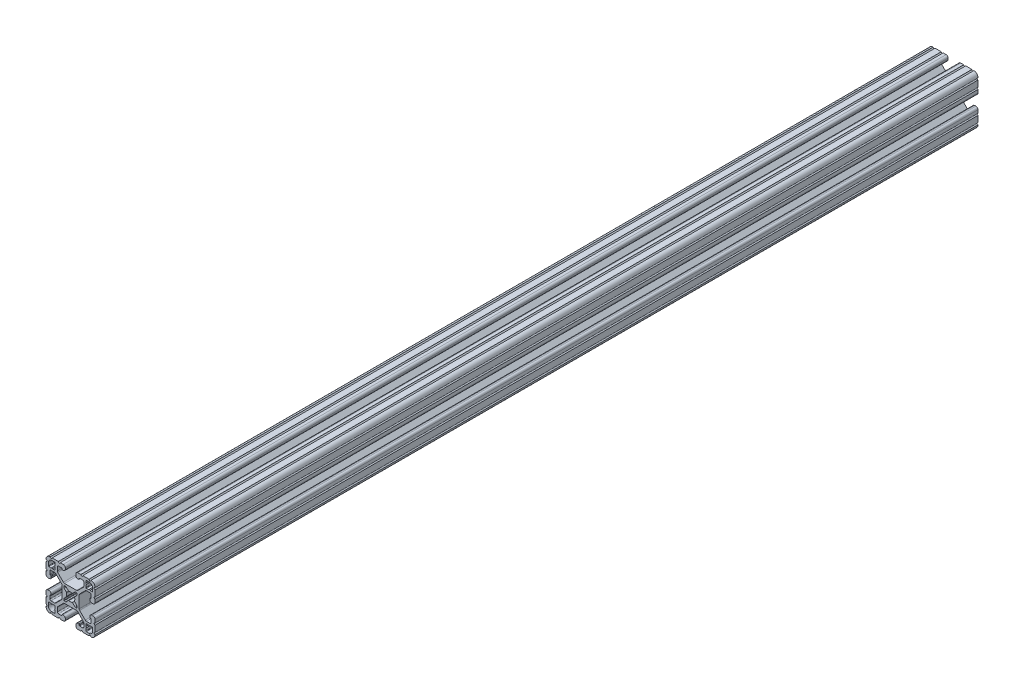
from build123d import *

# Parameters (mm, degrees)
EXTRUDE1_DEPTH = 685.8


with BuildPart() as part:
    # Sketch1 → Extrude1 (new body)
    with BuildSketch(Plane.XY):
        with BuildLine():
            Line((6.349777007, -14.984831919), (5.653061318, -14.984831848))
            ThreePointArc((5.653061318, -14.984831848), (4.539002167, -15.446080098), (4.077754017, -16.560139291))
            Line((4.077754017, -16.560139291), (4.077753935, -17.474692556))
            ThreePointArc((4.077753935, -17.474692556), (4.539002158, -18.588751741), (5.653061362, -19.049999918))
            Line((5.653061362, -19.049999918), (7.975599859, -19.05))
            ThreePointArc((7.975599859, -19.05), (8.737599929, -18.288), (9.4996, -19.05))
            Line((9.4996, -19.05), (14.298091988, -19.05))
            ThreePointArc((14.298091988, -19.05), (15.05987163, -18.288000032), (15.822092002, -19.049559142))
            ThreePointArc((15.822092002, -19.049559142), (18.110316678, -18.129769245), (19.049898398, -15.849599993))
            ThreePointArc((19.049898398, -15.849599993), (18.288000002, -15.087549199), (19.05, -14.3256))
            Line((19.05, -14.3256), (19.05, -9.499600141))
            ThreePointArc((19.05, -9.499600141), (18.288, -8.737600071), (19.05, -7.9756))
            Line((19.05, -7.9756), (19.05, -5.653061359))
            ThreePointArc((19.05, -5.653061359), (18.588751763, -4.53900218), (17.474692553, -4.077754017))
            Line((17.474692553, -4.077754017), (16.560139293, -4.077753935))
            ThreePointArc((16.560139293, -4.077753935), (15.446080122, -4.539002143), (14.98483193, -5.653061321))
            Line((14.98483193, -5.653061321), (14.984831848, -6.349776986))
            ThreePointArc((14.984831848, -6.349776986), (15.096428348, -6.619420887), (15.366075744, -6.731008942))
            Line((15.366075744, -6.731008942), (15.696937609, -6.730998691))
            ThreePointArc((15.696937609, -6.730998691), (15.966583472, -6.842585282), (16.078181438, -7.112226438))
            Line((16.078181438, -7.112226438), (16.078207121, -9.396837814))
            ThreePointArc((16.078207121, -9.396837814), (15.817838504, -10.026619018), (15.188068118, -10.287013801))
            Line((15.188068118, -10.287013801), (12.352560476, -10.287103022))
            ThreePointArc((12.352560476, -10.287103022), (11.865894357, -10.190173629), (11.453520834, -9.914153164))
            Line((11.453520834, -9.914153164), (7.114725376, -5.565926641))
            ThreePointArc((7.114725376, -5.565926641), (6.840134749, -5.154247475), (6.7437254, -4.668876499))
            Line((6.7437254, -4.668876499), (6.7437254, 4.641368628))
            ThreePointArc((6.7437254, 4.641368628), (6.840134749, 5.126739605), (7.114725376, 5.53841877))
            Line((7.114725376, 5.53841877), (11.480968187, 9.914152308))
            ThreePointArc((11.480968187, 9.914152308), (11.89334171, 10.190172773), (12.380007829, 10.287102166))
            Line((12.380007829, 10.287102166), (15.188068116, 10.287014567))
            ThreePointArc((15.188068116, 10.287014567), (15.817838279, 10.026619243), (16.078206356, 9.396837815))
            Line((16.078206356, 9.396837815), (16.078181509, 7.1122265))
            ThreePointArc((16.078181509, 7.1122265), (15.966583514, 6.842585324), (15.696937607, 6.730998762))
            Line((15.696937607, 6.730998762), (15.366075744, 6.731009012))
            ThreePointArc((15.366075744, 6.731009012), (15.096428376, 6.619420915), (14.984831919, 6.349777007))
            Line((14.984831919, 6.349777007), (14.984831848, 5.653061318))
            ThreePointArc((14.984831848, 5.653061318), (15.446080098, 4.539002167), (16.560139291, 4.077754017))
            Line((16.560139291, 4.077754017), (17.474692556, 4.077753935))
            ThreePointArc((17.474692556, 4.077753935), (18.588751741, 4.539002158), (19.049999918, 5.653061362))
            Line((19.049999918, 5.653061362), (19.05, 7.975599859))
            ThreePointArc((19.05, 7.975599859), (18.288, 8.737599929), (19.05, 9.4996))
            Line((19.05, 9.4996), (19.05, 14.298091988))
            ThreePointArc((19.05, 14.298091988), (18.288000032, 15.05987163), (19.049559142, 15.822092002))
            ThreePointArc((19.049559142, 15.822092002), (18.129769245, 18.110316678), (15.849599993, 19.049898398))
            ThreePointArc((15.849599993, 19.049898398), (15.087549199, 18.288000002), (14.3256, 19.05))
            Line((14.3256, 19.05), (9.499600141, 19.05))
            ThreePointArc((9.499600141, 19.05), (8.737600071, 18.288), (7.9756, 19.05))
            Line((7.9756, 19.05), (5.653061359, 19.05))
            ThreePointArc((5.653061359, 19.05), (4.53900218, 18.588751763), (4.077754017, 17.474692553))
            Line((4.077754017, 17.474692553), (4.077753935, 16.560139293))
            ThreePointArc((4.077753935, 16.560139293), (4.539002143, 15.446080122), (5.653061321, 14.98483193))
            Line((5.653061321, 14.98483193), (6.349776986, 14.984831848))
            ThreePointArc((6.349776986, 14.984831848), (6.619420887, 15.096428348), (6.731008942, 15.366075744))
            Line((6.731008942, 15.366075744), (6.730998691, 15.696937609))
            ThreePointArc((6.730998691, 15.696937609), (6.842585282, 15.966583472), (7.112226438, 16.078181438))
            Line((7.112226438, 16.078181438), (9.396837814, 16.078207121))
            ThreePointArc((9.396837814, 16.078207121), (10.026619018, 15.817838504), (10.287013801, 15.188068118))
            Line((10.287013801, 15.188068118), (10.287103022, 12.352560476))
            ThreePointArc((10.287103022, 12.352560476), (10.190173629, 11.865894357), (9.914153164, 11.453520834))
            Line((9.914153164, 11.453520834), (5.565926641, 7.114725376))
            ThreePointArc((5.565926641, 7.114725376), (5.154247475, 6.840134749), (4.668876499, 6.7437254))
            Line((4.668876499, 6.7437254), (-4.641368628, 6.7437254))
            ThreePointArc((-4.641368628, 6.7437254), (-5.126739605, 6.840134749), (-5.53841877, 7.114725376))
            Line((-5.53841877, 7.114725376), (-9.914152308, 11.480968187))
            ThreePointArc((-9.914152308, 11.480968187), (-10.190172773, 11.89334171), (-10.287102166, 12.380007829))
            Line((-10.287102166, 12.380007829), (-10.287014567, 15.188068116))
            ThreePointArc((-10.287014567, 15.188068116), (-10.026619243, 15.817838279), (-9.396837815, 16.078206356))
            Line((-9.396837815, 16.078206356), (-7.1122265, 16.078181509))
            ThreePointArc((-7.1122265, 16.078181509), (-6.842585324, 15.966583514), (-6.730998762, 15.696937607))
            Line((-6.730998762, 15.696937607), (-6.731008942, 15.366075744))
            ThreePointArc((-6.731008942, 15.366075744), (-6.619420905, 15.096428366), (-6.349777007, 14.984831919))
            Line((-6.349777007, 14.984831919), (-5.653061318, 14.984831848))
            ThreePointArc((-5.653061318, 14.984831848), (-4.539002167, 15.446080098), (-4.077754017, 16.560139291))
            Line((-4.077754017, 16.560139291), (-4.077753935, 17.474692556))
            ThreePointArc((-4.077753935, 17.474692556), (-4.539002158, 18.588751741), (-5.653061362, 19.049999918))
            Line((-5.653061362, 19.049999918), (-7.975599859, 19.05))
            ThreePointArc((-7.975599859, 19.05), (-8.737599929, 18.288), (-9.4996, 19.05))
            Line((-9.4996, 19.05), (-14.298091988, 19.05))
            ThreePointArc((-14.298091988, 19.05), (-15.05987163, 18.288000032), (-15.822092002, 19.049559142))
            ThreePointArc((-15.822092002, 19.049559142), (-18.110316678, 18.129769245), (-19.049898398, 15.849599993))
            ThreePointArc((-19.049898398, 15.849599993), (-18.288000002, 15.087549199), (-19.05, 14.3256))
            Line((-19.05, 14.3256), (-19.05, 9.499600141))
            ThreePointArc((-19.05, 9.499600141), (-18.288, 8.737600071), (-19.05, 7.9756))
            Line((-19.05, 7.9756), (-19.05, 5.653061359))
            ThreePointArc((-19.05, 5.653061359), (-18.588751763, 4.53900218), (-17.474692553, 4.077754017))
            Line((-17.474692553, 4.077754017), (-16.560139293, 4.077753935))
            ThreePointArc((-16.560139293, 4.077753935), (-15.446080122, 4.539002143), (-14.98483193, 5.653061321))
            Line((-14.98483193, 5.653061321), (-14.984831848, 6.349776986))
            ThreePointArc((-14.984831848, 6.349776986), (-15.096428348, 6.619420887), (-15.366075744, 6.731008942))
            Line((-15.366075744, 6.731008942), (-15.696937609, 6.730998691))
            ThreePointArc((-15.696937609, 6.730998691), (-15.966583472, 6.842585283), (-16.078181438, 7.112226438))
            Line((-16.078181438, 7.112226438), (-16.078207121, 9.396837814))
            ThreePointArc((-16.078207121, 9.396837814), (-15.817838504, 10.026619018), (-15.188068118, 10.287013802))
            Line((-15.188068118, 10.287013802), (-12.352560476, 10.287103022))
            ThreePointArc((-12.352560476, 10.287103022), (-11.865894357, 10.190173629), (-11.453520834, 9.914153164))
            Line((-11.453520834, 9.914153164), (-7.114725376, 5.565926641))
            ThreePointArc((-7.114725376, 5.565926641), (-6.840134749, 5.154247475), (-6.7437254, 4.668876499))
            Line((-6.7437254, 4.668876499), (-6.7437254, -4.641368628))
            ThreePointArc((-6.7437254, -4.641368628), (-6.840134749, -5.126739605), (-7.114725376, -5.53841877))
            Line((-7.114725376, -5.53841877), (-11.480968187, -9.914152308))
            ThreePointArc((-11.480968187, -9.914152308), (-11.89334171, -10.190172773), (-12.380007829, -10.287102166))
            Line((-12.380007829, -10.287102166), (-15.188068116, -10.287014567))
            ThreePointArc((-15.188068116, -10.287014567), (-15.817838279, -10.026619243), (-16.078206356, -9.396837815))
            Line((-16.078206356, -9.396837815), (-16.078181509, -7.1122265))
            ThreePointArc((-16.078181509, -7.1122265), (-15.966583514, -6.842585324), (-15.696937607, -6.730998762))
            Line((-15.696937607, -6.730998762), (-15.366075744, -6.731009012))
            ThreePointArc((-15.366075744, -6.731009012), (-15.096428376, -6.619420915), (-14.984831919, -6.349777007))
            Line((-14.984831919, -6.349777007), (-14.984831848, -5.653061318))
            ThreePointArc((-14.984831848, -5.653061318), (-15.446080098, -4.539002167), (-16.560139291, -4.077754017))
            Line((-16.560139291, -4.077754017), (-17.474692556, -4.077753935))
            ThreePointArc((-17.474692556, -4.077753935), (-18.588751741, -4.539002158), (-19.049999918, -5.653061362))
            Line((-19.049999918, -5.653061362), (-19.05, -7.975599859))
            ThreePointArc((-19.05, -7.975599859), (-18.288, -8.737599929), (-19.05, -9.4996))
            Line((-19.05, -9.4996), (-19.05, -14.298091988))
            ThreePointArc((-19.05, -14.298091988), (-18.288000032, -15.05987163), (-19.049559142, -15.822092002))
            ThreePointArc((-19.049559142, -15.822092002), (-18.129769245, -18.110316678), (-15.849599993, -19.049898398))
            ThreePointArc((-15.849599993, -19.049898398), (-15.087549199, -18.288000002), (-14.3256, -19.05))
            Line((-14.3256, -19.05), (-9.499600141, -19.05))
            ThreePointArc((-9.499600141, -19.05), (-8.737600071, -18.288), (-7.9756, -19.05))
            Line((-7.9756, -19.05), (-5.653061359, -19.05))
            ThreePointArc((-5.653061359, -19.05), (-4.53900218, -18.588751763), (-4.077754017, -17.474692553))
            Line((-4.077754017, -17.474692553), (-4.077753935, -16.560139293))
            ThreePointArc((-4.077753935, -16.560139293), (-4.539002143, -15.446080122), (-5.653061321, -14.98483193))
            Line((-5.653061321, -14.98483193), (-6.349776986, -14.984831848))
            ThreePointArc((-6.349776986, -14.984831848), (-6.619420887, -15.096428348), (-6.731008942, -15.366075744))
            Line((-6.731008942, -15.366075744), (-6.730998691, -15.696937609))
            ThreePointArc((-6.730998691, -15.696937609), (-6.842585282, -15.966583472), (-7.112226438, -16.078181438))
            Line((-7.112226438, -16.078181438), (-9.396837814, -16.078207121))
            ThreePointArc((-9.396837814, -16.078207121), (-10.026619018, -15.817838504), (-10.287013801, -15.188068118))
            Line((-10.287013801, -15.188068118), (-10.287103022, -12.352560476))
            ThreePointArc((-10.287103022, -12.352560476), (-10.190173629, -11.865894357), (-9.914153164, -11.453520834))
            Line((-9.914153164, -11.453520834), (-5.565926641, -7.114725376))
            ThreePointArc((-5.565926641, -7.114725376), (-5.154247475, -6.840134749), (-4.668876499, -6.7437254))
            Line((-4.668876499, -6.7437254), (4.641368628, -6.7437254))
            ThreePointArc((4.641368628, -6.7437254), (5.126739605, -6.840134749), (5.53841877, -7.114725376))
            Line((5.53841877, -7.114725376), (9.914152308, -11.480968187))
            ThreePointArc((9.914152308, -11.480968187), (10.190172773, -11.89334171), (10.287102166, -12.380007829))
            Line((10.287102166, -12.380007829), (10.287014567, -15.188068116))
            ThreePointArc((10.287014567, -15.188068116), (10.026619243, -15.817838279), (9.396837815, -16.078206356))
            Line((9.396837815, -16.078206356), (7.1122265, -16.078181509))
            ThreePointArc((7.1122265, -16.078181509), (6.842585324, -15.966583514), (6.730998762, -15.696937607))
            Line((6.730998762, -15.696937607), (6.731008942, -15.366075744))
            ThreePointArc((6.731008942, -15.366075744), (6.619420905, -15.096428366), (6.349777007, -14.984831919))
        make_face()
        with BuildLine():
            Line((1.582347442, 3.198793543), (3.292097227, 4.908543328))
            ThreePointArc((3.292097227, 4.908543328), (3.580509584, 5.101254304), (3.920715155, 5.1689254))
            Line((3.920715155, 5.1689254), (4.9149254, 5.1689254))
            ThreePointArc((4.9149254, 5.1689254), (5.094530522, 5.094530522), (5.1689254, 4.9149254))
            Line((5.1689254, 4.9149254), (5.1689254, 3.920715155))
            ThreePointArc((5.1689254, 3.920715155), (5.101254304, 3.580509584), (4.908543328, 3.292097227))
            Line((4.908543328, 3.292097227), (3.198793543, 1.582347442))
            ThreePointArc((3.198793543, 1.582347442), (3.095711236, 1.393016011), (3.111879183, 1.178048687))
            ThreePointArc((3.111879183, 1.178048687), (3.3274, 0), (3.111879183, -1.178048687))
            ThreePointArc((3.111879183, -1.178048687), (3.095711236, -1.393016011), (3.198793543, -1.582347442))
            Line((3.198793543, -1.582347442), (4.908543328, -3.292097227))
            ThreePointArc((4.908543328, -3.292097227), (5.101254304, -3.580509584), (5.1689254, -3.920715155))
            Line((5.1689254, -3.920715155), (5.1689254, -4.9149254))
            ThreePointArc((5.1689254, -4.9149254), (5.094530522, -5.094530522), (4.9149254, -5.1689254))
            Line((4.9149254, -5.1689254), (3.920715155, -5.1689254))
            ThreePointArc((3.920715155, -5.1689254), (3.580509584, -5.101254304), (3.292097227, -4.908543328))
            Line((3.292097227, -4.908543328), (1.582347442, -3.198793543))
            ThreePointArc((1.582347442, -3.198793543), (1.393016011, -3.095711236), (1.178048687, -3.111879183))
            ThreePointArc((1.178048687, -3.111879183), (0, -3.3274), (-1.178048687, -3.111879183))
            ThreePointArc((-1.178048687, -3.111879183), (-1.393016011, -3.095711236), (-1.582347442, -3.198793543))
            Line((-1.582347442, -3.198793543), (-3.292097227, -4.908543328))
            ThreePointArc((-3.292097227, -4.908543328), (-3.580509584, -5.101254304), (-3.920715155, -5.1689254))
            Line((-3.920715155, -5.1689254), (-4.9149254, -5.1689254))
            ThreePointArc((-4.9149254, -5.1689254), (-5.094530522, -5.094530522), (-5.1689254, -4.9149254))
            Line((-5.1689254, -4.9149254), (-5.1689254, -3.920715155))
            ThreePointArc((-5.1689254, -3.920715155), (-5.101254304, -3.580509584), (-4.908543328, -3.292097227))
            Line((-4.908543328, -3.292097227), (-3.198793543, -1.582347442))
            ThreePointArc((-3.198793543, -1.582347442), (-3.095711236, -1.393016011), (-3.111879183, -1.178048687))
            ThreePointArc((-3.111879183, -1.178048687), (-3.3274, 0), (-3.111879183, 1.178048687))
            ThreePointArc((-3.111879183, 1.178048687), (-3.095711236, 1.393016011), (-3.198793543, 1.582347442))
            Line((-3.198793543, 1.582347442), (-4.908543328, 3.292097227))
            ThreePointArc((-4.908543328, 3.292097227), (-5.101254304, 3.580509584), (-5.1689254, 3.920715155))
            Line((-5.1689254, 3.920715155), (-5.1689254, 4.9149254))
            ThreePointArc((-5.1689254, 4.9149254), (-5.094530522, 5.094530522), (-4.9149254, 5.1689254))
            Line((-4.9149254, 5.1689254), (-3.920715155, 5.1689254))
            ThreePointArc((-3.920715155, 5.1689254), (-3.580509584, 5.101254304), (-3.292097227, 4.908543328))
            Line((-3.292097227, 4.908543328), (-1.582347442, 3.198793543))
            ThreePointArc((-1.582347442, 3.198793543), (-1.393016011, 3.095711236), (-1.178048687, 3.111879183))
            ThreePointArc((-1.178048687, 3.111879183), (0, 3.3274), (1.178048687, 3.111879183))
            ThreePointArc((1.178048687, 3.111879183), (1.393016011, 3.095711236), (1.582347442, 3.198793543))
        make_face(mode=Mode.SUBTRACT)
        with BuildLine():
            Line((-11.8669054, 14.019430433), (-11.8669054, 12.24788))
            ThreePointArc((-11.8669054, 12.24788), (-11.978497716, 11.978472316), (-12.2479054, 11.86688))
            Line((-12.2479054, 11.86688), (-14.019455833, 11.86688))
            ThreePointArc((-14.019455833, 11.86688), (-14.020427836, 11.867073341), (-14.021251865, 11.867623929))
            Line((-14.021251865, 11.867623929), (-14.557512425, 12.403872831))
            ThreePointArc((-14.557512425, 12.403872831), (-14.559308484, 12.404616761), (-14.561104527, 12.403872792))
            Line((-14.561104527, 12.403872792), (-15.097341694, 11.867623968))
            ThreePointArc((-15.097341694, 11.867623968), (-15.098165736, 11.867073351), (-15.099137765, 11.86688))
            Line((-15.099137765, 11.86688), (-16.8707054, 11.86688))
            ThreePointArc((-16.8707054, 11.86688), (-17.140113084, 11.978472316), (-17.2517054, 12.24788))
            Line((-17.2517054, 12.24788), (-17.2517054, 14.45768))
            ThreePointArc((-17.2517054, 14.45768), (-16.433361747, 16.433336347), (-14.4577054, 17.25168))
            Line((-14.4577054, 17.25168), (-12.2479054, 17.25168))
            ThreePointArc((-12.2479054, 17.25168), (-11.978497716, 17.140087684), (-11.8669054, 16.87068))
            Line((-11.8669054, 16.87068), (-11.8669054, 15.099112365))
            ThreePointArc((-11.8669054, 15.099112365), (-11.867098751, 15.098140336), (-11.867649368, 15.097316294))
            Line((-11.867649368, 15.097316294), (-12.403898192, 14.561079127))
            ThreePointArc((-12.403898192, 14.561079127), (-12.40464216, 14.559283084), (-12.403898231, 14.557487025))
            Line((-12.403898231, 14.557487025), (-11.867649329, 14.021226465))
            ThreePointArc((-11.867649329, 14.021226465), (-11.867098741, 14.020402437), (-11.8669054, 14.019430433))
        make_face(mode=Mode.SUBTRACT)
        with BuildLine():
            Line((-14.019430433, -11.8669054), (-12.24788, -11.8669054))
            ThreePointArc((-12.24788, -11.8669054), (-11.978472316, -11.978497716), (-11.86688, -12.2479054))
            Line((-11.86688, -12.2479054), (-11.86688, -14.019455833))
            ThreePointArc((-11.86688, -14.019455833), (-11.867073341, -14.020427836), (-11.867623929, -14.021251865))
            Line((-11.867623929, -14.021251865), (-12.403872831, -14.557512425))
            ThreePointArc((-12.403872831, -14.557512425), (-12.404616761, -14.559308484), (-12.403872792, -14.561104527))
            Line((-12.403872792, -14.561104527), (-11.867623968, -15.097341694))
            ThreePointArc((-11.867623968, -15.097341694), (-11.867073351, -15.098165736), (-11.86688, -15.099137765))
            Line((-11.86688, -15.099137765), (-11.86688, -16.8707054))
            ThreePointArc((-11.86688, -16.8707054), (-11.978472316, -17.140113083), (-12.24788, -17.2517054))
            Line((-12.24788, -17.2517054), (-14.45768, -17.2517054))
            ThreePointArc((-14.45768, -17.2517054), (-16.433336347, -16.433361746), (-17.25168, -14.4577054))
            Line((-17.25168, -14.4577054), (-17.25168, -12.2479054))
            ThreePointArc((-17.25168, -12.2479054), (-17.140087684, -11.978497716), (-16.87068, -11.8669054))
            Line((-16.87068, -11.8669054), (-15.099112365, -11.8669054))
            ThreePointArc((-15.099112365, -11.8669054), (-15.098140336, -11.867098751), (-15.097316294, -11.867649368))
            Line((-15.097316294, -11.867649368), (-14.561079127, -12.403898192))
            ThreePointArc((-14.561079127, -12.403898192), (-14.559283084, -12.40464216), (-14.557487025, -12.403898231))
            Line((-14.557487025, -12.403898231), (-14.021226465, -11.867649329))
            ThreePointArc((-14.021226465, -11.867649329), (-14.020402437, -11.867098741), (-14.019430433, -11.8669054))
        make_face(mode=Mode.SUBTRACT)
        with BuildLine():
            Line((11.8669054, -14.019430433), (11.8669054, -12.24788))
            ThreePointArc((11.8669054, -12.24788), (11.978497716, -11.978472316), (12.2479054, -11.86688))
            Line((12.2479054, -11.86688), (14.019455833, -11.86688))
            ThreePointArc((14.019455833, -11.86688), (14.020427836, -11.867073341), (14.021251865, -11.867623929))
            Line((14.021251865, -11.867623929), (14.557512425, -12.403872831))
            ThreePointArc((14.557512425, -12.403872831), (14.559308484, -12.404616761), (14.561104527, -12.403872792))
            Line((14.561104527, -12.403872792), (15.097341694, -11.867623968))
            ThreePointArc((15.097341694, -11.867623968), (15.098165736, -11.867073351), (15.099137765, -11.86688))
            Line((15.099137765, -11.86688), (16.8707054, -11.86688))
            ThreePointArc((16.8707054, -11.86688), (17.140113084, -11.978472316), (17.2517054, -12.24788))
            Line((17.2517054, -12.24788), (17.2517054, -14.45768))
            ThreePointArc((17.2517054, -14.45768), (16.433361747, -16.433336347), (14.4577054, -17.25168))
            Line((14.4577054, -17.25168), (12.2479054, -17.25168))
            ThreePointArc((12.2479054, -17.25168), (11.978497716, -17.140087684), (11.8669054, -16.87068))
            Line((11.8669054, -16.87068), (11.8669054, -15.099112365))
            ThreePointArc((11.8669054, -15.099112365), (11.867098751, -15.098140336), (11.867649368, -15.097316294))
            Line((11.867649368, -15.097316294), (12.403898192, -14.561079127))
            ThreePointArc((12.403898192, -14.561079127), (12.40464216, -14.559283084), (12.403898231, -14.557487025))
            Line((12.403898231, -14.557487025), (11.867649329, -14.021226465))
            ThreePointArc((11.867649329, -14.021226465), (11.867098741, -14.020402436), (11.8669054, -14.019430433))
        make_face(mode=Mode.SUBTRACT)
        with BuildLine():
            Line((14.019430433, 11.8669054), (12.24788, 11.8669054))
            ThreePointArc((12.24788, 11.8669054), (11.978472316, 11.978497716), (11.86688, 12.2479054))
            Line((11.86688, 12.2479054), (11.86688, 14.019455833))
            ThreePointArc((11.86688, 14.019455833), (11.867073341, 14.020427836), (11.867623929, 14.021251865))
            Line((11.867623929, 14.021251865), (12.403872831, 14.557512425))
            ThreePointArc((12.403872831, 14.557512425), (12.404616761, 14.559308484), (12.403872792, 14.561104527))
            Line((12.403872792, 14.561104527), (11.867623968, 15.097341694))
            ThreePointArc((11.867623968, 15.097341694), (11.867073351, 15.098165736), (11.86688, 15.099137765))
            Line((11.86688, 15.099137765), (11.86688, 16.8707054))
            ThreePointArc((11.86688, 16.8707054), (11.978472316, 17.140113084), (12.24788, 17.2517054))
            Line((12.24788, 17.2517054), (14.45768, 17.2517054))
            ThreePointArc((14.45768, 17.2517054), (16.433336347, 16.433361747), (17.25168, 14.4577054))
            Line((17.25168, 14.4577054), (17.25168, 12.2479054))
            ThreePointArc((17.25168, 12.2479054), (17.140087684, 11.978497716), (16.87068, 11.8669054))
            Line((16.87068, 11.8669054), (15.099112365, 11.8669054))
            ThreePointArc((15.099112365, 11.8669054), (15.098140336, 11.867098751), (15.097316294, 11.867649368))
            Line((15.097316294, 11.867649368), (14.561079127, 12.403898192))
            ThreePointArc((14.561079127, 12.403898192), (14.559283084, 12.404642161), (14.557487025, 12.403898231))
            Line((14.557487025, 12.403898231), (14.021226465, 11.867649329))
            ThreePointArc((14.021226465, 11.867649329), (14.020402436, 11.867098741), (14.019430433, 11.8669054))
        make_face(mode=Mode.SUBTRACT)
    extrude(amount=-EXTRUDE1_DEPTH)


solid = part.part
